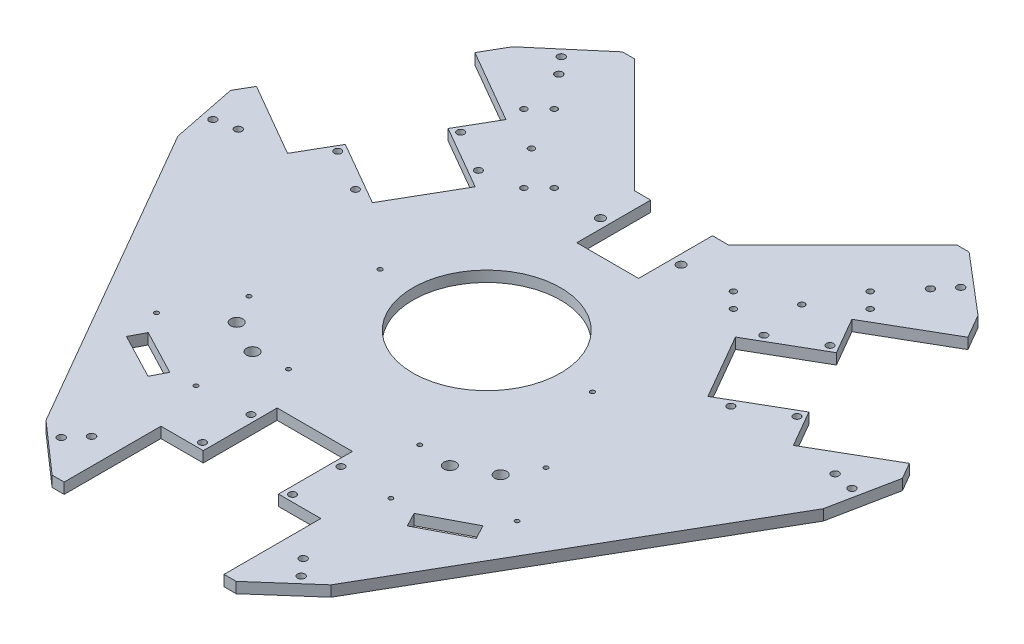
from build123d import *

# Parameters (mm, degrees)
SKETCH_1_R               = 55
EXTRUDE_1_DEPTH          = 8
CUT_EXTRUDE_7_DEPTH      = 358.196024614
HOLE_WIZARD_M5_1_D       = 5.3
PATTERN_CIRCULAR_5_COUNT = 3
CUT_EXTRUDE_2_DEPTH      = 358.196024614
CUT_EXTRUDE_2_DEPTH_BACK = 358.196024614
SKETCH_7_W               = 46
SKETCH_7_H               = 140
CUT_EXTRUDE_4_DEPTH      = 358.196024614
HOLE_WIZARD_M6_1_D       = 6.4
HOLE_WIZARD_M4_1_D       = 3.3
HOLE_WIZARD_M3_1_D       = 3.2
HOLE_WIZARD_9_0_9_1_D    = 9
CUT_EXTRUDE_6_DEPTH      = 10
HOLE_WIZARD_M5_3_D       = 5.5
HOLE_WIZARD_M4_1_2_D     = 4.5


with BuildPart() as part:
    # 草图1 → 凸台-拉伸1 (new body)
    with BuildSketch(Plane(origin=(0, 0, 0), x_dir=(1, 0, 0), z_dir=(0, 1, 0))):
        Polygon((-173.180567757, 192.422381227), (-250, 59.367221574), (-240.170967896, 10.34283858), (-106.041845025, -221.975617006), (-68.5, -255), (68.5, -255), (106.041845025, -221.975617006), (240.170967896, 10.34283858), (250, 59.367221574), (173.180567757, 192.422381227), (129, 230), (-129, 230), align=None)
        with Locations(Location((0, 0, 0), (0, 0, 270))):
            Circle(SKETCH_1_R, mode=Mode.SUBTRACT)
    extrude(amount=EXTRUDE_1_DEPTH)

    # 草图34 → 切除-拉伸7 (cut, through all)
    with BuildSketch(Plane(origin=(0, 8, 0), x_dir=(1, 0, 0), z_dir=(0, 1, 0))):
        Polygon((-144.482648893, 115.748711306), (-128.732648893, 143.028511525), (-183.456761017, 174.623492392), (-242.956761017, 71.566469341), (-188.232648893, 39.971488475), (-172.482648893, 67.251288694), (-124.851251684, 39.751288694), (-96.851251684, 88.248711306), align=None)
        Polygon((172.482648893, 67.251288694), (188.232648893, 39.971488475), (242.956761017, 71.566469341), (183.456761017, 174.623492392), (128.732648893, 143.028511525), (144.482648893, 115.748711306), (96.851251684, 88.248711306), (124.851251684, 39.751288694), align=None)
        Polygon((-28, -183), (-59.5, -183), (-59.5, -255), (59.5, -255), (59.5, -183), (28, -183), (28, -128), (-28, -128), align=None)
    extrude(amount=-CUT_EXTRUDE_7_DEPTH, mode=Mode.SUBTRACT)

    # M5 间隙孔1 (through all)
    with Locations(Plane(origin=(0, 0, 0), x_dir=(-1, 0, 0), z_dir=(0, -1, 0))):
        with Locations((106.225607337, 100.011851027), (137.402521874, 118.011851027), (139.725607337, 41.988148973), (170.902521874, 59.988148973)):
            hole_wizard_m5_1 = Hole(HOLE_WIZARD_M5_1_D / 2)

    # 阵列(圆周)5: M5 间隙孔1 ×3 about axis
    pattern_circular_5_axis = Axis((0, 0, 0), (0, 1, 0))
    for i in range(1, PATTERN_CIRCULAR_5_COUNT):
        add(hole_wizard_m5_1.rotate(pattern_circular_5_axis, i * 360 / PATTERN_CIRCULAR_5_COUNT), mode=Mode.SUBTRACT)

    # 草图5 → 切除-拉伸2 (cut, two sides: drawn at the far end of the back side and taken through both)
    with BuildSketch(Plane(origin=(0, 8, 0), x_dir=(1, 0, 0), z_dir=(0, 1, 0)).offset(-CUT_EXTRUDE_2_DEPTH_BACK)):
        Polygon((35, 145), (120, 230), (-120, 230), (-35, 145), align=None)
    extrude(amount=CUT_EXTRUDE_2_DEPTH + CUT_EXTRUDE_2_DEPTH_BACK, mode=Mode.SUBTRACT)

    # 草图7 → 切除-拉伸4 (cut, through all)
    with BuildSketch(Plane(origin=(0, 8, 0), x_dir=(1, 0, 0), z_dir=(0, 1, 0))):
        with Locations((0, 160)):
            Rectangle(SKETCH_7_W, SKETCH_7_H)
    extrude(amount=-CUT_EXTRUDE_4_DEPTH, mode=Mode.SUBTRACT)

    # M6 间隙孔1 (through all)
    with Locations(Plane(origin=(0, 8, 0), x_dir=(1, 0, 0), z_dir=(0, 1, 0))):
        with Locations((30, 114.64), (-30, 114.64)):
            Hole(HOLE_WIZARD_M6_1_D / 2)

    # Hole Wizard M4 _1 (through all)
    with Locations(Plane(origin=(0, 8, 0), x_dir=(1, 0, 0), z_dir=(0, 1, 0))):
        with Locations((-79, -0.36), (79, -0.36)):
            Hole(HOLE_WIZARD_M4_1_D / 2)

    # 电池座 M3 间隙孔1 (through all)
    with Locations(Plane(origin=(0, 0, 0), x_dir=(-1, 0, 0), z_dir=(0, -1, 0))):
        with Locations((-110.507914412, -66.440289893), (-72.5, -143.903561461), (-134.161542188, -111.623316496), (-48.846372224, -98.720534858)):
            hole_wizard_m3_1 = Hole(HOLE_WIZARD_M3_1_D / 2)

    # Ø9.0 (9) 直径孔1 (through all)
    with Locations(Plane(origin=(0, 0, 0), x_dir=(-1, 0, 0), z_dir=(0, -1, 0))):
        with Locations((-98.248822178, -87.870284237), (-73.442454631, -100.856589683)):
            hole_wizard_9_0_9_1 = Hole(HOLE_WIZARD_9_0_9_1_D / 2)

    # 草图21 → 切除-拉伸6 (cut)
    with BuildSketch(Plane.XZ):
        Polygon((90.903946749, 144.992020949), (96.469506226, 155.623321326), (130.135290754, 137.99904965), (124.569731277, 127.367749272), align=None)
    cut_extrude_6 = extrude(amount=-CUT_EXTRUDE_6_DEPTH, mode=Mode.SUBTRACT)

    # 镜向1: 电池座 M3 间隙孔1, Ø9.0 (9) 直径孔1, 切除-拉伸6 across plane
    add(hole_wizard_m3_1.mirror(Plane(origin=(0, 0, 0), x_dir=(0, 0, 1), z_dir=(1, 0, 0))), mode=Mode.SUBTRACT)
    add(hole_wizard_9_0_9_1.mirror(Plane(origin=(0, 0, 0), x_dir=(0, 0, 1), z_dir=(1, 0, 0))), mode=Mode.SUBTRACT)
    add(cut_extrude_6.mirror(Plane(origin=(0, 0, 0), x_dir=(0, 0, 1), z_dir=(1, 0, 0))), mode=Mode.SUBTRACT)

    # 立柱 M5 间隙孔3 (through all)
    with Locations(Plane(origin=(0, 0, 0), x_dir=(-1, 0, 0), z_dir=(0, -1, 0))):
        with Locations((-237.779820534, 34.02527989), (-222.092017976, 37.170570164), (-138.279747165, 191.912875123), (-148.645986827, 204.100617953), (-89.298360296, -227.381404927), (-78.730557738, -215.368014518)):
            hole_wizard_m5_3 = Hole(HOLE_WIZARD_M5_3_D / 2)

    # 镜向4: 立柱 M5 间隙孔3 across plane
    add(hole_wizard_m5_3.mirror(Plane(origin=(0, 0, 0), x_dir=(0, 0, 1), z_dir=(1, 0, 0))), mode=Mode.SUBTRACT)

    # Hole Wizard M4 _1 2 (through all)
    with Locations(Plane(origin=(0, 0, 0), x_dir=(-1, 0, 0), z_dir=(0, -1, 0))):
        with Locations((128.880701979, 156.505934529), (117.56699348, 167.819643028), (66.655305235, 116.907954782), (77.969013734, 105.594246284), (100.596430732, 133.878517531)):
            hole_wizard_m4_1_2 = Hole(HOLE_WIZARD_M4_1_2_D / 2)

    # 镜向5: Hole Wizard M4 _1 2 across plane
    add(hole_wizard_m4_1_2.mirror(Plane(origin=(0, 0, 0), x_dir=(0, 0, 1), z_dir=(1, 0, 0))), mode=Mode.SUBTRACT)


solid = part.part
